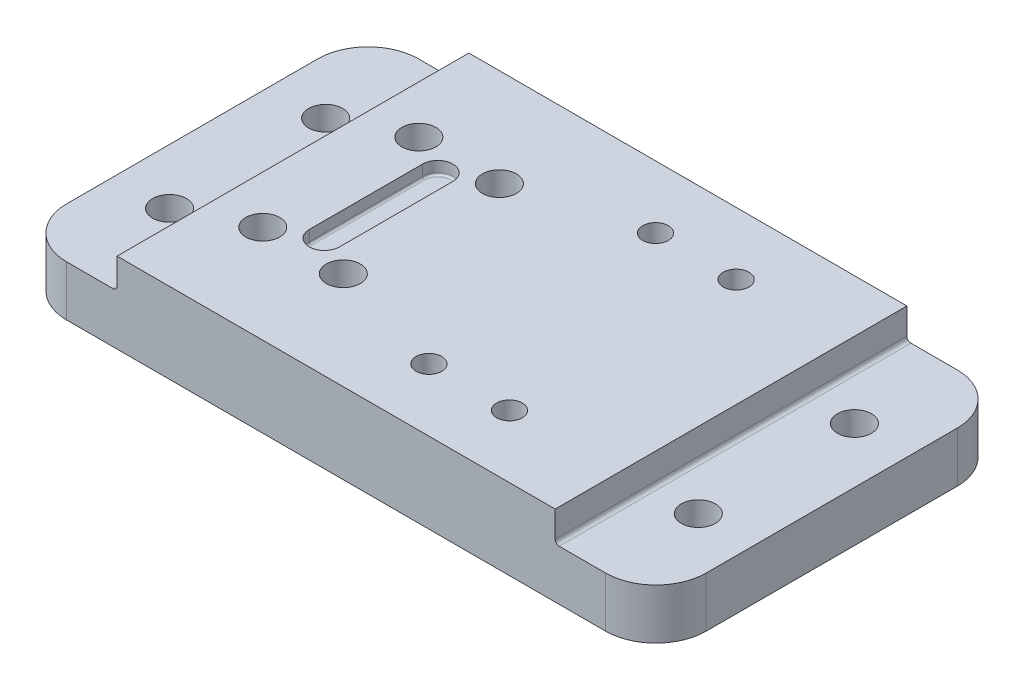
from build123d import *

# Parameters (mm, degrees)
SKETCH1_W                                            = 254
SKETCH1_H                                            = 139.7
BOSS_EXTRUDE1_DEPTH                                  = 19.05
FILLET1_R                                            = 20
SKETCH2_W                                            = 254
SKETCH2_H                                            = 3.05
CUT_EXTRUDE1_DEPTH                                   = 190.757720528
SKETCH8_W                                            = 40
SKETCH8_H                                            = 139.7
CUT_EXTRUDE2_DEPTH                                   = 12
M12_TAPPED_HOLE2_D                                   = 10.2
M12_TAPPED_HOLE2_DEPTH                               = 43.99
M12_TAPPED_HOLE2_TIP                                 = 3.064389157
M12_CLEARANCE_HOLE1_D                                = 13.5
CBORE_FOR_M12_HEX_SOCKET_HEAD_CAP_SCREW1_D           = 13.5
CBORE_FOR_M12_HEX_SOCKET_HEAD_CAP_SCREW1_CBORE_D     = 20
CBORE_FOR_M12_HEX_SOCKET_HEAD_CAP_SCREW1_CBORE_DEPTH = 13
CUT_EXTRUDE3_DEPTH                                   = 5.08
FILLET2_R                                            = 0.79375
FILLET3_R                                            = 1.5875


with BuildPart() as part:
    # Sketch1 → Boss-Extrude1 (new, symmetric)
    with BuildSketch(Plane(origin=(0, 0, 0), x_dir=(1, 0, 0), z_dir=(0, 1, 0))):
        Rectangle(SKETCH1_W, SKETCH1_H)
    extrude(amount=BOSS_EXTRUDE1_DEPTH, both=True)

    # Fillet1
    fillet1_edges = [part.edges().sort_by_distance(p)[0] for p in [
        (-127, 0, -69.85),
        (127, 0, -69.85),
        (127, 0, 69.85),
        (-127, 0, 69.85),
    ]]
    fillet(fillet1_edges, radius=FILLET1_R)

    # Sketch2 → Cut-Extrude1 (cut, through all)
    with BuildSketch(Plane.XY.offset(69.85)):
        with Locations((0, 17.525)):
            Rectangle(SKETCH2_W, SKETCH2_H)
        with Locations((0, -17.525)):
            Rectangle(SKETCH2_W, SKETCH2_H)
    extrude(amount=-CUT_EXTRUDE1_DEPTH, mode=Mode.SUBTRACT)

    # Sketch8 → Cut-Extrude2 (cut)
    with BuildSketch(Plane(origin=(0, 16, 0), x_dir=(1, 0, 0), z_dir=(0, 1, 0))):
        with Locations((-107, 0)):
            Rectangle(SKETCH8_W, SKETCH8_H)
        with Locations((107, 0)):
            Rectangle(SKETCH8_W, SKETCH8_H)
    extrude(amount=-CUT_EXTRUDE2_DEPTH, mode=Mode.SUBTRACT)

    # M12 Tapped Hole2
    with Locations(Plane(origin=(0, 16, 0), x_dir=(-1, 0, 0), z_dir=(0, 1, 0))):
        with Locations((-12, 45), (-12, -45), (-44, -45), (-44, 45)):
            Hole(M12_TAPPED_HOLE2_D / 2, depth=M12_TAPPED_HOLE2_DEPTH)
            with Locations((0, 0, -(M12_TAPPED_HOLE2_DEPTH + M12_TAPPED_HOLE2_TIP / 2))):  # 118° drill point
                Cone(0, M12_TAPPED_HOLE2_D / 2, M12_TAPPED_HOLE2_TIP, mode=Mode.SUBTRACT)

    # M12 Clearance Hole1 (through all)
    with Locations(Plane(origin=(0, 4, 0), x_dir=(1, 0, 0), z_dir=(0, 1, 0))):
        with Locations((-105, 31), (-105, -31), (105, 31), (105, -31)):
            Hole(M12_CLEARANCE_HOLE1_D / 2)

    # CBORE for M12 Hex Socket Head Cap Screw1 (through all)
    with Locations(Plane.XZ.offset(16)):
        with Locations((-36, -31), (-68, 31), (-36, 31), (-68, -31)):
            CounterBoreHole(CBORE_FOR_M12_HEX_SOCKET_HEAD_CAP_SCREW1_D / 2, CBORE_FOR_M12_HEX_SOCKET_HEAD_CAP_SCREW1_CBORE_D / 2, CBORE_FOR_M12_HEX_SOCKET_HEAD_CAP_SCREW1_CBORE_DEPTH)

    # Sketch11 → Cut-Extrude3 (cut)
    with BuildSketch(Plane(origin=(0, 16, 0), x_dir=(1, 0, 0), z_dir=(0, 1, 0))):
        with BuildLine():
            Line((-46, 22.5), (-46, -22.5))
            ThreePointArc((-46, -22.5), (-52, -28.5), (-58, -22.5))
            Line((-58, -22.5), (-58, 22.5))
            ThreePointArc((-58, 22.5), (-52, 28.5), (-46, 22.5))
        make_face()
    extrude(amount=-CUT_EXTRUDE3_DEPTH, mode=Mode.SUBTRACT)

    # Fillet2
    fillet2_edges = [part.edges().sort_by_distance(p)[0] for p in [
        (-52, 10.92, -28.5),
        (-46, 10.92, 0),
        (-52, 10.92, 28.5),
        (-58, 10.92, 0),
    ]]
    fillet(fillet2_edges, radius=FILLET2_R)

    # Fillet3
    fillet3_edges = [part.edges().sort_by_distance(p)[0] for p in [
        (-87, 4, 0),
        (87, 4, 0),
    ]]
    fillet(fillet3_edges, radius=FILLET3_R)


solid = part.part
